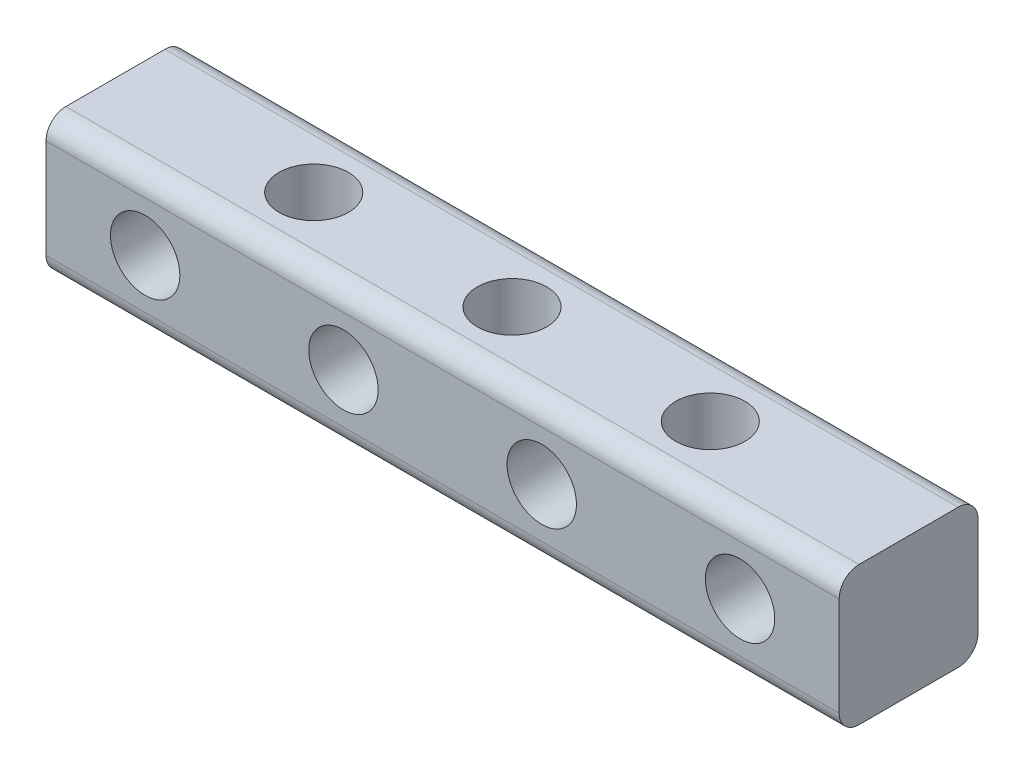
from build123d import *

# Parameters (mm, degrees)
SKETCH_1_W          = 40
SKETCH_1_H          = 7
SKETCH_1_R          = 1.75
EXTRUDE_1_DEPTH     = 7
SKETCH_2_R          = 1.75
CUT_EXTRUDE_1_DEPTH = 7
FILLET_1_R          = 1


with BuildPart() as part:
    # 草图1 → 凸台-拉伸1 (new body)
    with BuildSketch(Plane.XY):
        with Locations((20, 3.5)):
            Rectangle(SKETCH_1_W, SKETCH_1_H)
        with Locations((5, 3.5)):
            Circle(SKETCH_1_R, mode=Mode.SUBTRACT)
        with Locations((15, 3.5)):
            Circle(SKETCH_1_R, mode=Mode.SUBTRACT)
        with Locations((25, 3.5)):
            Circle(SKETCH_1_R, mode=Mode.SUBTRACT)
        with Locations((35, 3.5)):
            Circle(SKETCH_1_R, mode=Mode.SUBTRACT)
    extrude(amount=EXTRUDE_1_DEPTH)

    # 草图2 → 切除-拉伸1 (cut)
    with BuildSketch(Plane(origin=(0, 7, 0), x_dir=(1, 0, 0), z_dir=(0, 1, 0))):
        with Locations(Location((20, -3.5, 0), (0, 0, 270))):
            Circle(SKETCH_2_R)
        with Locations(Location((30, -3.5, 0), (0, 0, 270))):
            Circle(SKETCH_2_R)
        with Locations(Location((10, -3.5, 0), (0, 0, 270))):
            Circle(SKETCH_2_R)
    extrude(amount=-CUT_EXTRUDE_1_DEPTH, mode=Mode.SUBTRACT)

    # 圆角1
    fillet_1_edges = [part.edges().sort_by_distance(p)[0] for p in [
        (20, 7, 7),
        (20, 7, 0),
        (20, 0, 0),
        (20, 0, 7),
    ]]
    fillet(fillet_1_edges, radius=FILLET_1_R)


solid = part.part
